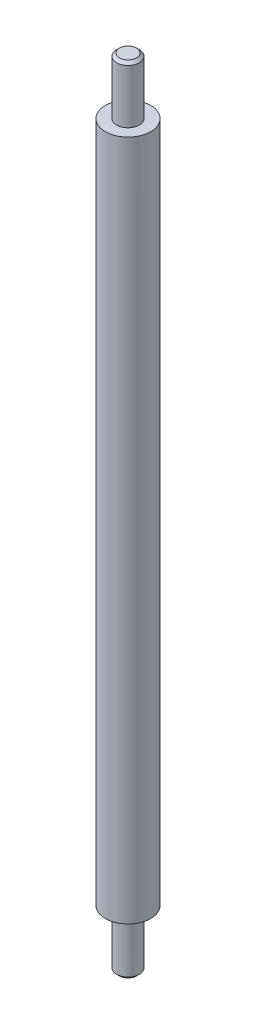
from build123d import *

# Parameters (mm, degrees)
SKETCH1_R      = 4
EXTRUDE1_DEPTH = 140
EXTRUDE2_START = -10
SKETCH2_R      = 4
SKETCH2_R_2    = 2
EXTRUDE2_DEPTH = 10
SKETCH3_R      = 4
SKETCH3_R_2    = 2
EXTRUDE3_DEPTH = 10
CHAMFER1_SIZE  = 0.5


with BuildPart() as part:
    # Sketch1 → Extrude1 (new body)
    with BuildSketch(Plane(origin=(0, 0, 0), x_dir=(1, 0, 0), z_dir=(0, 1, 0))):
        with Locations(Location((0, 0, 0), (0, 0, 270))):
            Circle(SKETCH1_R)
    extrude(amount=EXTRUDE1_DEPTH)

    # Sketch2 → Extrude2 (cut)
    with BuildSketch(Plane(origin=(0, 140, 0), x_dir=(1, 0, 0), z_dir=(0, 1, 0)).offset(EXTRUDE2_START)):
        with Locations(Location((0, 0, 0), (0, 0, 270))):
            Circle(SKETCH2_R)
        with Locations(Location((0, 0, 0), (0, 0, 270))):
            Circle(SKETCH2_R_2, mode=Mode.SUBTRACT)
    extrude(amount=EXTRUDE2_DEPTH, mode=Mode.SUBTRACT)

    # Sketch3 → Extrude3 (cut)
    with BuildSketch(Plane.XZ):
        with Locations(Location((0, 0, 0), (0, 0, 270))):
            Circle(SKETCH3_R)
        with Locations(Location((0, 0, 0), (0, 0, 90))):
            Circle(SKETCH3_R_2, mode=Mode.SUBTRACT)
    extrude(amount=-EXTRUDE3_DEPTH, mode=Mode.SUBTRACT)

    # Chamfer1
    chamfer1_edges = [part.edges().sort_by_distance(p)[0] for p in [
        (0, 0, -2),
        (0, 140, -2),
    ]]
    chamfer(chamfer1_edges, length=CHAMFER1_SIZE)


solid = part.part
